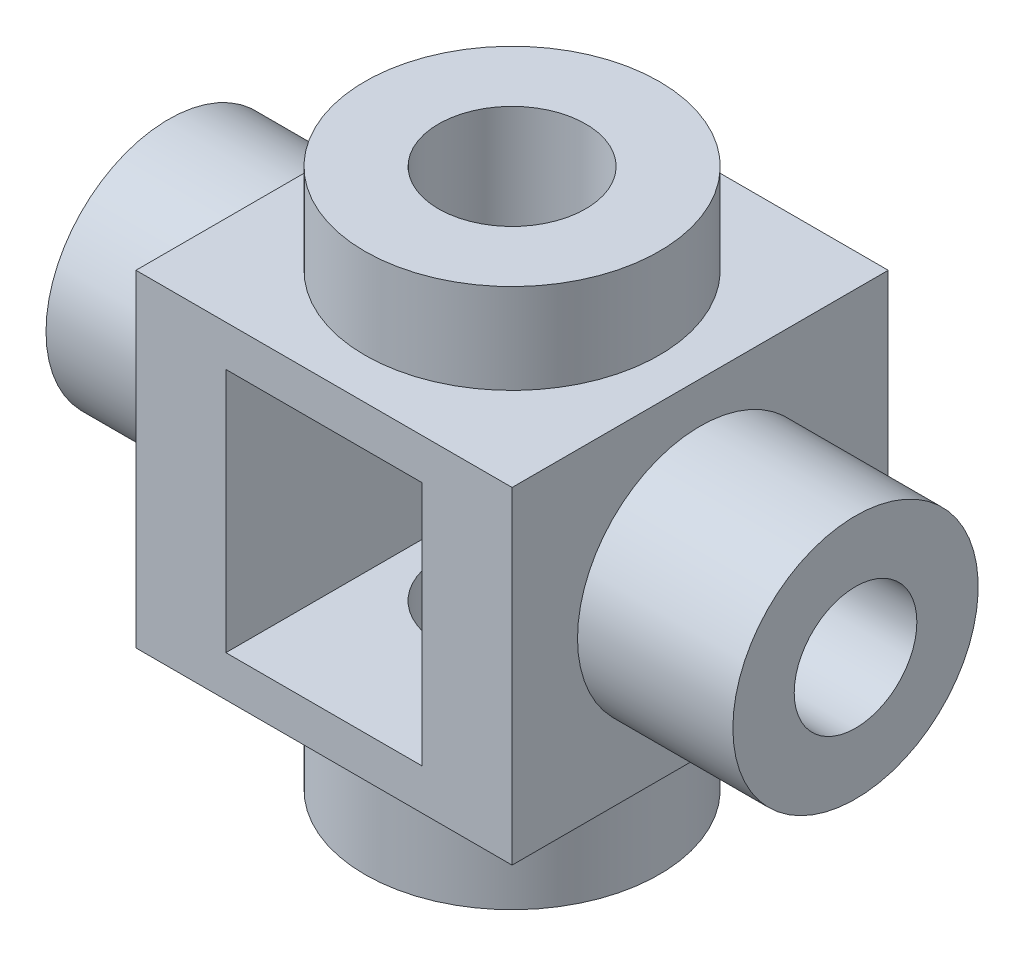
from build123d import *

# Parameters (mm, degrees)
SKETCH1_R                = 15
SKETCH1_R_2              = 7.5
BOSS_EXTRUDE1_DEPTH      = 42
SKETCH2_W                = 46
SKETCH2_H                = 40
BOSS_EXTRUDE2_DEPTH      = 23
SKETCH3_W                = 24
SKETCH3_H                = 30
CUT_EXTRUDE1_DEPTH       = 66.421708935
HOLE1_D                  = 15
BOSS_EXTRUDE3_DEPTH      = 11
BOSS_EXTRUDE3_DEPTH_BACK = 55
SKETCH6_R                = 18
SKETCH7_W                = 24
SKETCH7_H                = 30
CUT_EXTRUDE2_DEPTH       = 72.449282712
HOLE2_D                  = 18


with BuildPart() as part:
    # Sketch1 → Boss-Extrude1 (new, symmetric)
    with BuildSketch(Plane(origin=(0, 0, 0), x_dir=(0, 0, -1), z_dir=(1, 0, 0))):
        with Locations(Location((0, 0, 0), (0, 0, 180))):
            Circle(SKETCH1_R)
        with Locations(Location((0, 0, 0), (0, 0, 180))):
            Circle(SKETCH1_R_2, mode=Mode.SUBTRACT)
    extrude(amount=BOSS_EXTRUDE1_DEPTH, both=True)

    # Sketch2 → Boss-Extrude2 (add, symmetric)
    with BuildSketch(Plane.XY):
        Rectangle(SKETCH2_W, SKETCH2_H)
    extrude(amount=BOSS_EXTRUDE2_DEPTH, both=True)

    # Sketch3 → Cut-Extrude1 (cut, through all)
    with BuildSketch(Plane.XY.offset(23)):
        Rectangle(SKETCH3_W, SKETCH3_H)
    extrude(amount=-CUT_EXTRUDE1_DEPTH, mode=Mode.SUBTRACT)

    # Hole1 (through all)
    with Locations(Plane(origin=(42, 0, 0), x_dir=(0, 0, -1), z_dir=(1, 0, 0))):
        with Locations((0, 0)):
            Hole(HOLE1_D / 2)

    # Sketch6 → Boss-Extrude3 (add, two sides: drawn at the far end of the back side and taken through both)
    with BuildSketch(Plane(origin=(0, 20, 0), x_dir=(1, 0, 0), z_dir=(0, 1, 0)).offset(-BOSS_EXTRUDE3_DEPTH_BACK)):
        with Locations(Location((0, 0, 0), (0, 0, 270))):
            Circle(SKETCH6_R)
    extrude(amount=BOSS_EXTRUDE3_DEPTH + BOSS_EXTRUDE3_DEPTH_BACK)

    # Sketch7 → Cut-Extrude2 (cut, through all)
    with BuildSketch(Plane.XY.offset(23)):
        Rectangle(SKETCH7_W, SKETCH7_H)
    extrude(amount=-CUT_EXTRUDE2_DEPTH, mode=Mode.SUBTRACT)

    # Hole2 (through all)
    with Locations(Plane(origin=(0, 31, 0), x_dir=(1, 0, 0), z_dir=(0, 1, 0))):
        with Locations((0, 0)):
            Hole(HOLE2_D / 2)


solid = part.part
